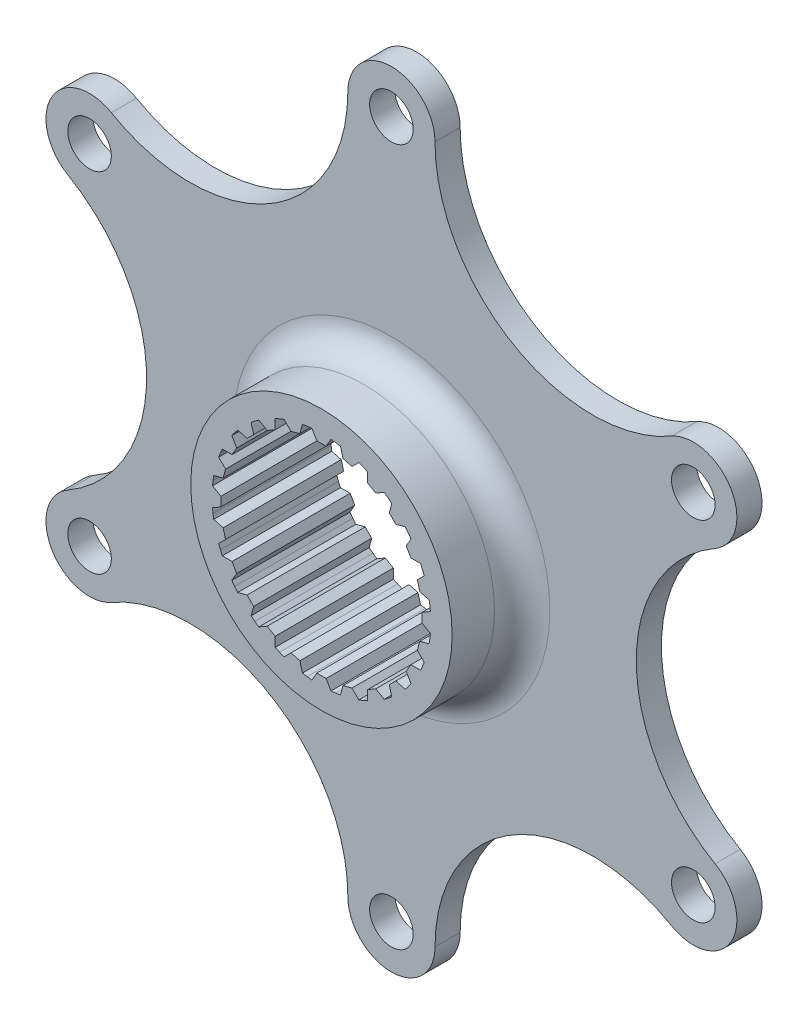
from build123d import *

# Parameters (mm, degrees)
SKETCH1_R           = 115
BOSS_EXTRUDE1_DEPTH = 13.55
CUT_EXTRUDE1_DEPTH  = 165.87695412
SKETCH3_R           = 95
SKETCH3_R_2         = 30
CUT_EXTRUDE13_DEPTH = 16.06
FILLET1_R           = 6.35
CUT_EXTRUDE14_START = -5.27
SKETCH7_R           = 95
SKETCH7_R_2         = 30
CUT_EXTRUDE14_DEPTH = 5.27
FILLET2_R           = 3.175
SKETCH8_R           = 115
SKETCH8_R_2         = 95
CUT_EXTRUDE17_DEPTH = 165.87695412
SKETCH9_R           = 5
CUT_EXTRUDE20_DEPTH = 10
SKETCH10_R          = 95
CUT_EXTRUDE21_DEPTH = 10


with BuildPart() as part:
    # Sketch1 → Boss-Extrude1 (new, symmetric)
    with BuildSketch(Plane.XY):
        Circle(SKETCH1_R)
    extrude(amount=BOSS_EXTRUDE1_DEPTH, both=True)

    # Sketch2 → Cut-Extrude1 (cut, through all)
    with BuildSketch(Plane.XY.offset(13.55)):
        Polygon((2.179683155, 25.005179098), (1.065531645, 23.075412075), (0, 23.075412075), (-1.065531645, 23.075412075), (-2.179683155, 25.005179098), (-3.276207429, 24.885266027), (-4.366404331, 24.717291793), (-4.943131584, 22.564916358), (-7.001580653, 22.013356593), (-8.577228829, 23.589004769), (-9.605354152, 23.189376274), (-10.614928564, 22.744961902), (-10.614928564, 20.516658882), (-12.460483511, 19.451127237), (-14.390250533, 20.565278747), (-15.27991187, 19.913168849), (-16.140062965, 19.222600444), (-15.563335705, 17.070225009), (-17.070225009, 15.563335705), (-19.222600444, 16.140062965), (-19.913168845, 15.279911875), (-20.565278747, 14.390250533), (-19.451127237, 12.460483511), (-20.516658882, 10.614928564), (-22.744961902, 10.614928564), (-23.189376271, 9.605354159), (-23.589004769, 8.577228829), (-22.013356593, 7.001580653), (-22.564916358, 4.943131584), (-24.717291794, 4.366404324), (-24.885266027, 3.276207429), (-25.005179098, 2.179683155), (-23.075412075, 1.065531645), (-23.075412075, -1.065531645), (-25.005179098, -2.179683155), (-24.885266028, -3.276207422), (-24.717291794, -4.366404324), (-22.564916358, -4.943131584), (-22.013356593, -7.001580653), (-23.589004769, -8.577228829), (-23.189376274, -9.605354152), (-22.744961902, -10.614928564), (-20.516658882, -10.614928564), (-19.451127237, -12.460483511), (-20.565278747, -14.390250533), (-19.913168849, -15.27991187), (-19.222600444, -16.140062965), (-17.070225009, -15.563335705), (-15.563335705, -17.070225009), (-16.140062965, -19.222600444), (-15.279911875, -19.913168845), (-14.390250533, -20.565278747), (-12.460483511, -19.451127237), (-10.614928564, -20.516658882), (-10.614928564, -22.744961902), (-9.605354159, -23.189376271), (-8.577228829, -23.589004769), (-7.001580653, -22.013356593), (-4.943131584, -22.564916358), (-4.366404324, -24.717291794), (-3.276207429, -24.885266027), (-2.179683155, -25.005179098), (-1.065531645, -23.075412075), (1.065531645, -23.075412075), (2.179683155, -25.005179098), (3.276207422, -24.885266028), (4.366404324, -24.717291794), (4.943131584, -22.564916358), (7.001580653, -22.013356593), (8.577228829, -23.589004769), (9.605354152, -23.189376274), (10.614928564, -22.744961902), (10.614928564, -20.516658882), (12.460483511, -19.451127237), (14.390250533, -20.565278747), (15.27991187, -19.913168849), (16.140062965, -19.222600444), (15.563335705, -17.070225009), (17.070225009, -15.563335705), (19.222600444, -16.140062965), (19.913168845, -15.279911875), (20.565278747, -14.390250533), (19.451127237, -12.460483511), (20.516658882, -10.614928564), (22.744961902, -10.614928564), (23.189376271, -9.605354159), (23.589004769, -8.577228829), (22.013356593, -7.001580653), (22.564916358, -4.943131584), (24.717291794, -4.366404324), (24.885266027, -3.276207429), (25.005179098, -2.179683155), (23.075412075, -1.065531645), (23.075412075, 1.065531645), (25.005179098, 2.179683155), (24.885266028, 3.276207422), (24.717291794, 4.366404324), (22.564916358, 4.943131584), (22.013356593, 7.001580653), (23.589004769, 8.577228829), (23.189376274, 9.605354152), (22.744961902, 10.614928564), (20.516658882, 10.614928564), (19.451127237, 12.460483511), (20.565278747, 14.390250533), (19.913168849, 15.27991187), (19.222600444, 16.140062965), (17.070225009, 15.563335705), (15.563335705, 17.070225009), (16.140062965, 19.222600444), (15.279911876, 19.913168845), (14.390250533, 20.565278747), (12.460483511, 19.451127237), (10.614928564, 20.516658882), (10.614928564, 22.744961902), (9.605354159, 23.189376271), (8.577228829, 23.589004769), (7.001580653, 22.013356593), (4.943131584, 22.564916358), (4.366404324, 24.717291794), (3.276207429, 24.885266027), align=None)
    extrude(amount=-CUT_EXTRUDE1_DEPTH, mode=Mode.SUBTRACT)

    # Sketch3 → Cut-Extrude13 (cut)
    with BuildSketch(Plane.XY.offset(13.55)):
        Circle(SKETCH3_R)
        Circle(SKETCH3_R_2, mode=Mode.SUBTRACT)
    extrude(amount=-CUT_EXTRUDE13_DEPTH, mode=Mode.SUBTRACT)

    # Fillet1
    fillet1_edges = [part.edges().sort_by_distance(p)[0] for p in [
        (-30, 0, -2.51),
    ]]
    fillet(fillet1_edges, radius=FILLET1_R)

    # Sketch7 → Cut-Extrude14 (cut)
    with BuildSketch(Plane(origin=(0, 0, -13.55), x_dir=(-1, 0, 0), z_dir=(0, 0, -1)).offset(CUT_EXTRUDE14_START)):
        Circle(SKETCH7_R)
        Circle(SKETCH7_R_2, mode=Mode.SUBTRACT)
    extrude(amount=CUT_EXTRUDE14_DEPTH, mode=Mode.SUBTRACT)

    # Fillet2
    fillet2_edges = [part.edges().sort_by_distance(p)[0] for p in [
        (30, 0, -8.28),
    ]]
    fillet(fillet2_edges, radius=FILLET2_R)

    # Sketch8 → Cut-Extrude17 (cut, through all)
    with BuildSketch(Plane(origin=(0, 0, -13.55), x_dir=(-1, 0, 0), z_dir=(0, 0, -1))):
        Circle(SKETCH8_R)
        Circle(SKETCH8_R_2, mode=Mode.SUBTRACT)
    extrude(amount=-CUT_EXTRUDE17_DEPTH, mode=Mode.SUBTRACT)

    # Sketch9 → Cut-Extrude20 (cut)
    with BuildSketch(Plane(origin=(0, 0, -8.28), x_dir=(-1, 0, 0), z_dir=(0, 0, -1))):
        with Locations((0, 80)):
            Circle(SKETCH9_R)
        with Locations((69.282032303, 40)):
            Circle(SKETCH9_R)
        with Locations((69.282032303, -40)):
            Circle(SKETCH9_R)
        with Locations((0, -80)):
            Circle(SKETCH9_R)
        with Locations((-69.282032303, -40)):
            Circle(SKETCH9_R)
        with Locations((-69.282032303, 40)):
            Circle(SKETCH9_R)
    extrude(amount=-CUT_EXTRUDE20_DEPTH, mode=Mode.SUBTRACT)

    # Sketch10 → Cut-Extrude21 (cut)
    with BuildSketch(Plane(origin=(0, 0, -8.28), x_dir=(-1, 0, 0), z_dir=(0, 0, -1))):
        Circle(SKETCH10_R)
        with BuildLine():
            ThreePointArc((-74.282032303, 31.339745962), (-77.942286341, 45), (-64.282032303, 48.660254038))
            ThreePointArc((-64.282032303, 48.660254038), (-28.094011813, 48.660255848), (-10, 80))
            ThreePointArc((-10, 80), (0, 90), (10, 80))
            ThreePointArc((10, 80), (28.094011813, 48.660255848), (64.282032303, 48.660254038))
            ThreePointArc((64.282032303, 48.660254038), (74.282032303, 48.660254038), (79.282032303, 40))
            ThreePointArc((79.282032303, 40), (77.942286341, 35), (74.282032303, 31.339745962))
            ThreePointArc((74.282032303, 31.339745962), (56.188023625, 0), (74.282032303, -31.339745962))
            ThreePointArc((74.282032303, -31.339745962), (77.942286341, -35), (79.282032303, -40))
            ThreePointArc((79.282032303, -40), (74.282032303, -48.660254038), (64.282032303, -48.660254038))
            ThreePointArc((64.282032303, -48.660254038), (28.094011813, -48.660255848), (10, -80))
            ThreePointArc((10, -80), (0, -90), (-10, -80))
            ThreePointArc((-10, -80), (-28.094011813, -48.660255848), (-64.282032303, -48.660254038))
            ThreePointArc((-64.282032303, -48.660254038), (-77.942286341, -45), (-74.282032303, -31.339745962))
            ThreePointArc((-74.282032303, -31.339745962), (-56.188023625, 0), (-74.282032303, 31.339745962))
        make_face(mode=Mode.SUBTRACT)
    extrude(amount=-CUT_EXTRUDE21_DEPTH, mode=Mode.SUBTRACT)


solid = part.part
